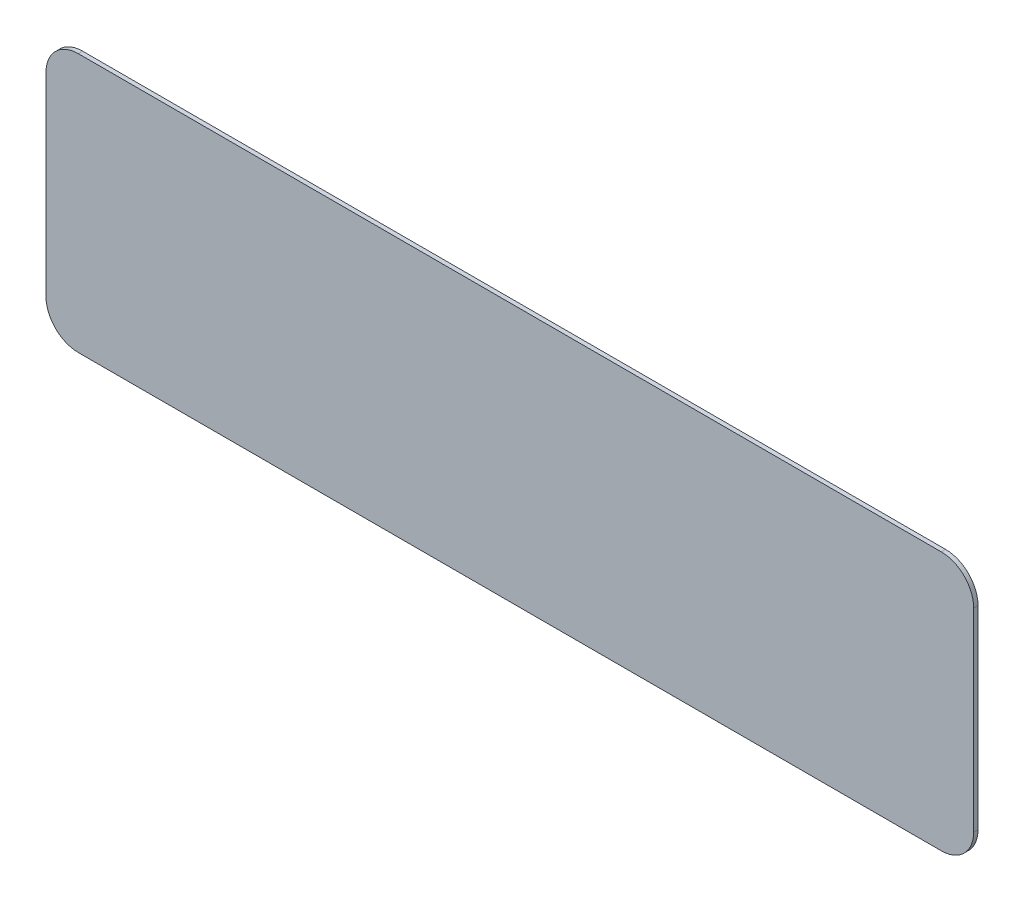
from build123d import *

# Parameters (mm, degrees)
BOSS_EXTRUDE1_DEPTH = 0.2


with BuildPart() as part:
    # Sketch1 → Boss-Extrude1 (new body)
    with BuildSketch(Plane.XY):
        with BuildLine():
            Line((-20, -6), (20, -6))
            ThreePointArc((20, -6), (21.060660172, -5.560660172), (21.5, -4.5))
            Line((21.5, -4.5), (21.5, 4.5))
            ThreePointArc((21.5, 4.5), (21.060660172, 5.560660172), (20, 6))
            Line((20, 6), (-20, 6))
            ThreePointArc((-20, 6), (-21.060660172, 5.560660172), (-21.5, 4.5))
            Line((-21.5, 4.5), (-21.5, -4.5))
            ThreePointArc((-21.5, -4.5), (-21.060660172, -5.560660172), (-20, -6))
        make_face()
    extrude(amount=BOSS_EXTRUDE1_DEPTH)


solid = part.part
